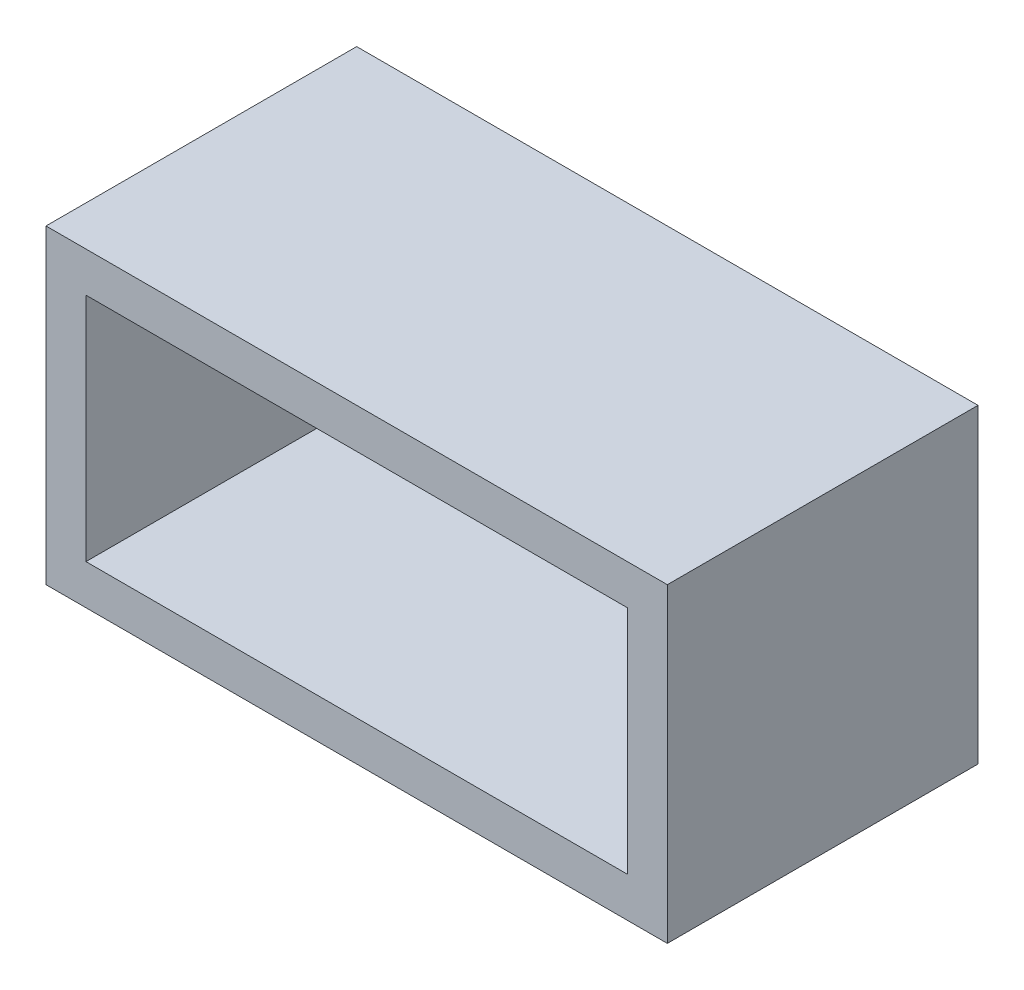
from build123d import *

# Parameters (mm, degrees)
SOFT_CONTACT_AND_WRAP_START     = -1
SOFT_CONTACT_AND_WRAP_PROFILE_W = 14
SOFT_CONTACT_AND_WRAP_PROFILE_H = 7
SOFT_CONTACT_AND_WRAP_DEPTH     = 7
FINGER_SLIP_POCKET_PROFILE_W    = 12.2
FINGER_SLIP_POCKET_PROFILE_H    = 5.2
OPEN_TOP_SLIP_POCKET_DEPTH      = 7
PAD_CAPTURE_M2_START            = -50
PAD_CAPTURE_M2_PROFILE_R        = 1.1
PAD_CAPTURE_M2_DEPTH            = 86.510561809


with BuildPart() as part:
    # Soft_contact_and_wrap_profile → Soft_contact_and_wrap (new body)
    with BuildSketch(Plane.XY.offset(SOFT_CONTACT_AND_WRAP_START)):
        with Locations((21, -17.5)):
            Rectangle(SOFT_CONTACT_AND_WRAP_PROFILE_W, SOFT_CONTACT_AND_WRAP_PROFILE_H)
    extrude(amount=SOFT_CONTACT_AND_WRAP_DEPTH)

    # Finger_slip_pocket_profile → Open_top_slip_pocket (cut)
    with BuildSketch(Plane.XY):
        with Locations((21, -17.5)):
            Rectangle(FINGER_SLIP_POCKET_PROFILE_W, FINGER_SLIP_POCKET_PROFILE_H)
    extrude(amount=OPEN_TOP_SLIP_POCKET_DEPTH, mode=Mode.SUBTRACT)

    # Pad_capture_M2_profile → Pad_capture_M2 (cut, through all)
    with BuildSketch(Plane.XY.offset(PAD_CAPTURE_M2_START)):
        with Locations(Location((18, -17.5, 0), (0, 0, 180))):
            Circle(PAD_CAPTURE_M2_PROFILE_R)
        with Locations(Location((24, -17.5, 0), (0, 0, 180))):
            Circle(PAD_CAPTURE_M2_PROFILE_R)
    extrude(amount=PAD_CAPTURE_M2_DEPTH, mode=Mode.SUBTRACT)


solid = part.part
